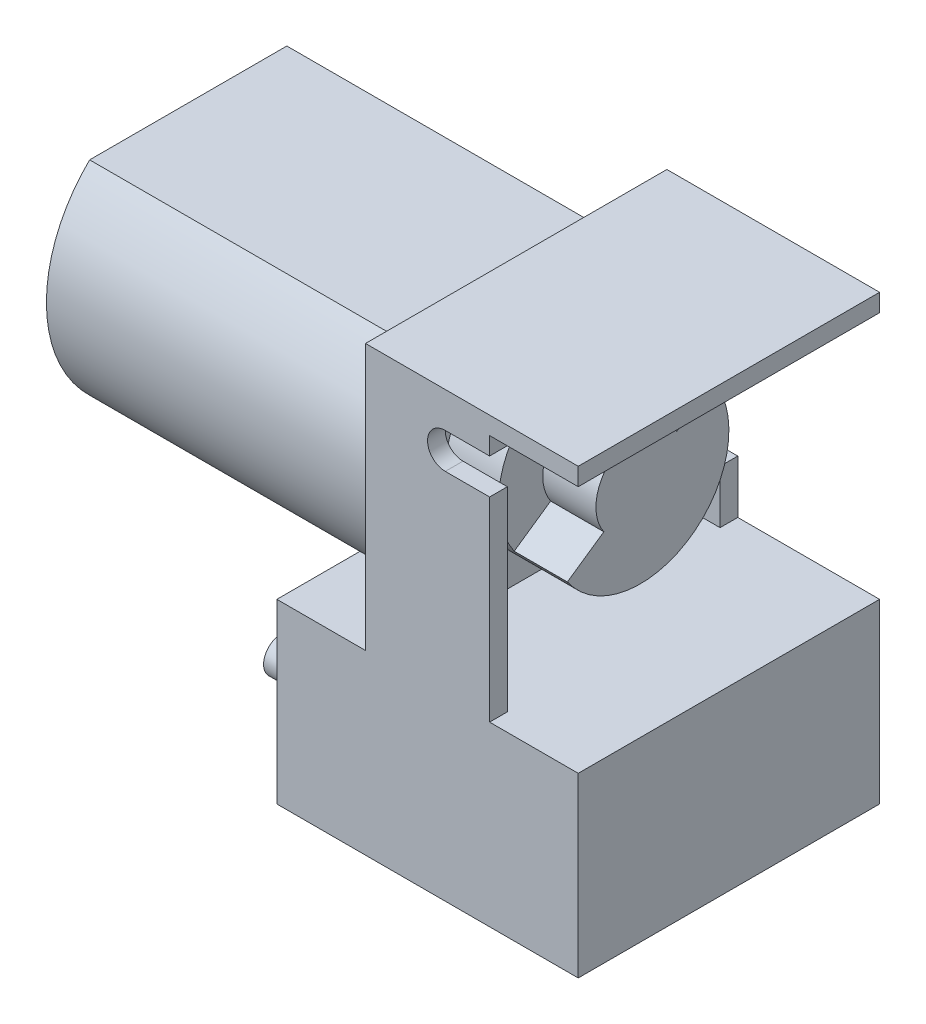
from build123d import *

# Parameters (mm, degrees)
BOSS_EXTRUDE1_DEPTH     = 8.5
CUT_EXTRUDE1_DEPTH      = 24.334523779
CUT_EXTRUDE1_DEPTH_BACK = 2.5
SKETCH2_W               = 16
SKETCH2_H               = 14
SKETCH3_W               = 3
SKETCH3_H               = 3
SKETCH3_R               = 0.6
BOSS_EXTRUDE2_DEPTH     = 1
BOSS_EXTRUDE3_DEPTH     = 18.5
SKETCH5_R               = 5
BOSS_EXTRUDE4_DEPTH     = 6
CUT_EXTRUDE2_START      = -3
CUT_EXTRUDE2_DEPTH      = 3
SKETCH7_R               = 1
SKETCH7_R_2             = 0.7
BOSS_EXTRUDE5_DEPTH     = 4.5


with BuildPart() as part:
    # Sketch1 → Boss-Extrude1 (new, symmetric)
    with BuildSketch(Plane.XY):
        with BuildLine():
            Line((-8.5, 5), (-8.5, -5))
            Line((-8.5, -5), (8.5, -5))
            Line((8.5, -5), (8.5, 5))
            Line((8.5, 5), (3.5, 5))
            Line((3.5, 5), (3.5, 16))
            Line((3.5, 16), (1, 16))
            ThreePointArc((1, 16), (0, 17), (1, 18))
            Line((1, 18), (3.5, 18))
            Line((3.5, 18), (3.5, 19))
            Line((3.5, 19), (8.5, 19))
            Line((8.5, 19), (8.5, 20))
            Line((8.5, 20), (-3.5, 20))
            Line((-3.5, 20), (-3.5, 5))
            Line((-3.5, 5), (-8.5, 5))
        make_face()
    extrude(amount=BOSS_EXTRUDE1_DEPTH, both=True)

    # Sketch2 → Cut-Extrude1 (cut, two sides: drawn at the far end of the back side and taken through both)
    with BuildSketch(Plane(origin=(0, 0, 0), x_dir=(0, 0, -1), z_dir=(1, 0, 0)).offset(-CUT_EXTRUDE1_DEPTH_BACK)):
        with Locations((0.5, 12)):
            Rectangle(SKETCH2_W, SKETCH2_H)
    extrude(amount=CUT_EXTRUDE1_DEPTH + CUT_EXTRUDE1_DEPTH_BACK, mode=Mode.SUBTRACT)

    # Sketch3 → Boss-Extrude2 (add)
    with BuildSketch(Plane(origin=(0, 0, -8.5), x_dir=(-1, 0, 0), z_dir=(0, 0, -1))):
        with Locations((1, 6.5)):
            Rectangle(SKETCH3_W, SKETCH3_H)
        with Locations((1, 6.5)):
            Circle(SKETCH3_R, mode=Mode.SUBTRACT)
    extrude(amount=-BOSS_EXTRUDE2_DEPTH)

    # Sketch4 → Boss-Extrude3 (add)
    with BuildSketch(Plane.ZY.offset(3.5)):
        with BuildLine():
            Line((-5.562148865, 18.25), (5.562148865, 18.25))
            ThreePointArc((5.562148865, 18.25), (8, 12.5), (5.562148865, 6.75))
            Line((5.562148865, 6.75), (-5.562148865, 6.75))
            ThreePointArc((-5.562148865, 6.75), (-8, 12.5), (-5.562148865, 18.25))
        make_face()
    extrude(amount=BOSS_EXTRUDE3_DEPTH)

    # Sketch5 → Boss-Extrude4 (add)
    with BuildSketch(Plane(origin=(-2.5, 0, 0), x_dir=(0, 0, -1), z_dir=(1, 0, 0))):
        with Locations(Location((0, 12.5, 0), (0, 0, 90))):
            Circle(SKETCH5_R)
    extrude(amount=BOSS_EXTRUDE4_DEPTH)

    # Sketch6 → Cut-Extrude2 (cut)
    with BuildSketch(Plane(origin=(3.5, 0, 0), x_dir=(0, 0, -1), z_dir=(1, 0, 0)).offset(CUT_EXTRUDE2_START)):
        with BuildLine():
            Line((4.111517555, 15.345245752), (2.055758778, 13.922622876))
            ThreePointArc((2.055758778, 13.922622876), (-1.422622876, 14.555758778), (-2.055758778, 11.077377124))
            Line((-2.055758778, 11.077377124), (-4.111517555, 9.654754248))
            ThreePointArc((-4.111517555, 9.654754248), (-2.845245752, 16.611517555), (4.111517555, 15.345245752))
        make_face()
    extrude(amount=CUT_EXTRUDE2_DEPTH, mode=Mode.SUBTRACT)

    # Sketch7 → Boss-Extrude5 (add)
    # profile 1 of 2: a face of its own
    with BuildSketch(Plane.ZY.offset(8.5)):
        with Locations(Location((-3.75, -2.301826995, 0), (0, 0, 180))):
            Circle(SKETCH7_R)
        with Locations((-3.75, -2.301826995)):
            Circle(SKETCH7_R_2, mode=Mode.SUBTRACT)
    # profile 2 of 2: a face of its own
    with BuildSketch(Plane.ZY.offset(8.5)):
        with Locations(Location((3.75, -2.301826995, 0), (0, 0, 180))):
            Circle(SKETCH7_R)
        with Locations((3.75, -2.301826995)):
            Circle(SKETCH7_R_2, mode=Mode.SUBTRACT)
    extrude(amount=BOSS_EXTRUDE5_DEPTH)


solid = part.part
